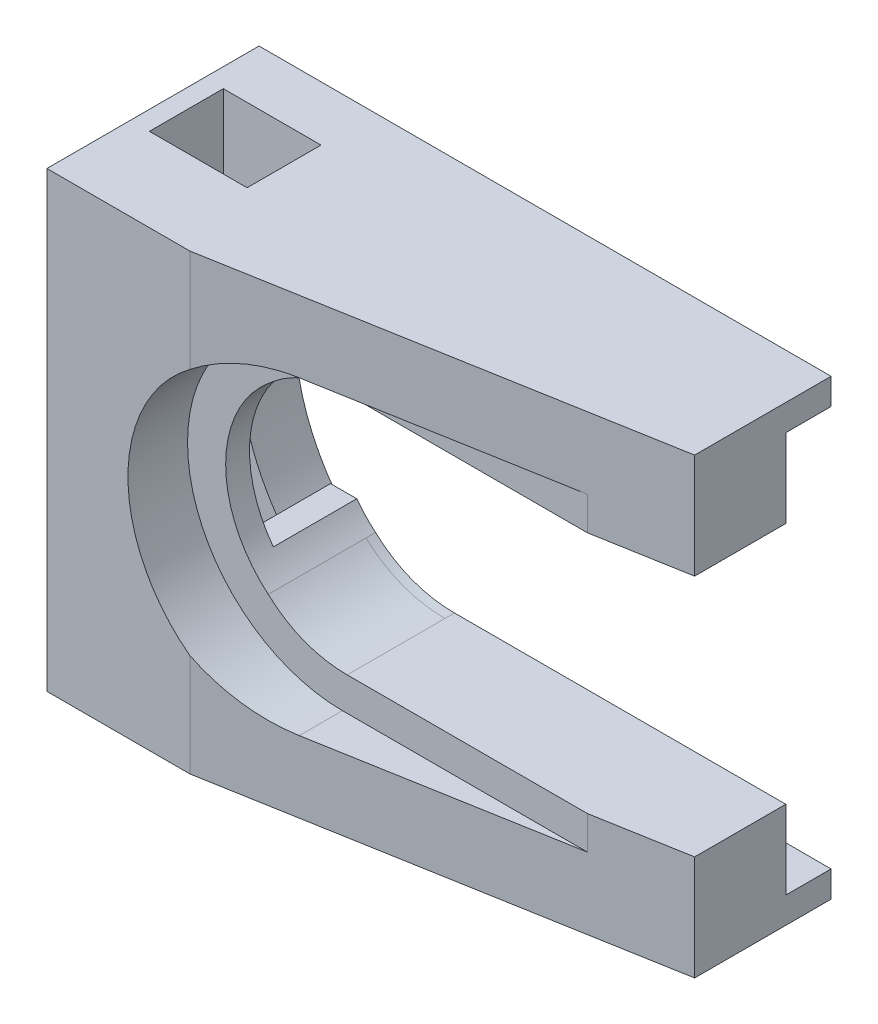
from build123d import *

# Parameters (mm, degrees)
SKETCH_1_24X19_W         = 19
SKETCH_1_24X19_H         = 24
EXTRUDE_1_33_DEPTH       = 33
CUT_EXTRUDE_2_REACH      = 38.377
CUT_EXTRUDE_4_2_DEPTH    = 1.9
CUT_EXTRUDE_6_3_REACH    = 29.71
SKETCH_7_5_W             = 24
SKETCH_7_5_H             = 19
EXTRUDE_7_DEPTH          = 5
CUT_EXTRUDE_10_4_REACH   = 41.925
SKETCH_11_W              = 8.5
SKETCH_11_H              = 3.1
CUT_EXTRUDE_11_5_DEPTH   = 4.9
SKETCH_11D1_W            = 6
SKETCH_11D1_H            = 3.1
CUT_EXTRUDE_11D1_6_DEPTH = 10
CUT_EXTRUDE_12_9_REACH   = 31.655
CUT_EXTRUDE_11_DEPTH     = 3.5
SKETCH_5903_W            = 53.98
SKETCH_5903_H            = 19
CUT_EXTRUDE_12_DEPTH     = 1
CUT_EXTRUDE_13_DEPTH     = 40.102429623
CUT_EXTRUDE_15_REACH     = 33.036
SKETCH_5021_R            = 3.5
EXTRUDE_2_DEPTH          = 0.4
SKETCH_7445_W            = 0.8
SKETCH_7445_H            = 3.1
EXTRUDE_3_DEPTH          = 19
CUT_EXTRUDE_16_DEPTH     = 32.036269144
SKETCH_14_W              = 54.018014823
SKETCH_14_H              = 29.926878018
CUT_EXTRUDE_17_DEPTH     = 28.710286942


with BuildPart() as part:
    # 1底部方形_24x19 → 1凸台-拉伸_高33 (new body)
    with BuildSketch(Plane(origin=(0, 0, 0), x_dir=(0, 1, 0), z_dir=(0, 0, 1))):
        Rectangle(SKETCH_1_24X19_W, SKETCH_1_24X19_H)
    extrude(amount=EXTRUDE_1_33_DEPTH)

    # 2吸嘴停靠渐变槽 → 2切除-拉伸 (cut, up to next)
    with BuildSketch(Plane.XY.offset(33), mode=Mode.PRIVATE) as cut_extrude_2_sk1:
        with BuildLine():
            Line((12, -5.1), (12, 5.1))
            Line((12, 5.1), (-1.9, 5.1))
            add(Edge.make_bspline(
                [(-5.213938048, 3.830222216), (-3.829124073, 5.093205317), (-1.9, 5.1)],
                knots=[0, 0, 0, 1, 1, 1], degree=2))
            ThreePointArc((-5.213938048, 3.830222216), (-7, 0), (-5.213938048, -3.830222216))
            add(Edge.make_bspline(
                [(-5.213938048, -3.830222216), (-3.829124073, -5.093205317), (-1.9, -5.1)],
                knots=[0, 0, 0, 1, 1, 1], degree=2))
            Line((-1.9, -5.1), (12, -5.1))
        make_face()
    cut_extrude_2_tool1 = extrude(cut_extrude_2_sk1.sketch, amount=-CUT_EXTRUDE_2_REACH, mode=Mode.PRIVATE) & part.part
    add(cut_extrude_2_tool1.solids().sort_by_distance((3.017719, 0, 33))[0], mode=Mode.SUBTRACT)

    # 4反光板停靠槽 → 4切除-拉伸2 (cut)
    with BuildSketch(Plane.XY.offset(25)):
        with BuildLine():
            Line((-0.7, 8.4), (12, 8.4))
            Line((12, 8.4), (12, -8.4))
            Line((12, -8.4), (-0.7, -8.4))
            ThreePointArc((-0.7, -8.4), (-10.5, 0), (-0.7, 8.4))
        make_face()
    extrude(amount=-CUT_EXTRUDE_4_2_DEPTH, mode=Mode.SUBTRACT)

    # 6反光板小圆柱 → 6切除-拉伸3 (cut, up to next)
    with BuildSketch(Plane.XY.offset(23.1), mode=Mode.PRIVATE) as cut_extrude_6_3_sk1:
        with BuildLine():
            Line((-2.1, -6.3), (12, -6.3))
            Line((12, -6.3), (12, 6.3))
            Line((12, 6.3), (-2.1, 6.3))
            ThreePointArc((-2.1, 6.3), (-8.4, 0), (-2.1, -6.3))
        make_face()
    cut_extrude_6_3_tool1 = extrude(cut_extrude_6_3_sk1.sketch, amount=-CUT_EXTRUDE_6_3_REACH, mode=Mode.PRIVATE) & part.part
    add(cut_extrude_6_3_tool1.solids().sort_by_distance((2.424095, 0, 23.1))[0], mode=Mode.SUBTRACT)

    # 7草图5 → 7凸台-拉伸_底板厚度 (add)
    with BuildSketch(Plane(origin=(0, 0, 0), x_dir=(1, 0, 0), z_dir=(0, 0, -1))):
        Rectangle(SKETCH_7_5_W, SKETCH_7_5_H)
    extrude(amount=-EXTRUDE_7_DEPTH)

    # 10切除-拉伸4: up to this face of the body (flat: up to its plane)
    cut_extrude_10_4_end = Plane(part.part.faces().sort_by_distance((0, -9.5, 16.5))[0])
    # Sketch 10 → 10切除-拉伸4 (cut, up to the picked face)
    with BuildSketch(Plane(origin=(0, 9.5, 0), x_dir=(-1, 0, 0), z_dir=(0, 1, 0)), mode=Mode.PRIVATE) as cut_extrude_10_4_sk1:
        Polygon((-12, 31.162738066), (-12, 33), (9, 33), align=None)
    cut_extrude_10_4_tool1 = split(extrude(cut_extrude_10_4_sk1.sketch, amount=-CUT_EXTRUDE_10_4_REACH, mode=Mode.PRIVATE), bisect_by=cut_extrude_10_4_end, keep=Keep.BOTH, mode=Mode.PRIVATE)
    add(cut_extrude_10_4_tool1.solids().sort_by(Axis((5, 9.5, 32.387579), (0, -1, 0)))[0], mode=Mode.SUBTRACT)

    # Sketch 11 → 11切除-拉伸5 (cut)
    with BuildSketch(Plane(origin=(-12, 0, 0), x_dir=(0, -1, 0), z_dir=(-1, 0, 0))):
        with Locations((-5.25, 26.95)):
            Rectangle(SKETCH_11_W, SKETCH_11_H)
        with Locations((5.25, 26.95)):
            Rectangle(SKETCH_11_W, SKETCH_11_H)
    extrude(amount=-CUT_EXTRUDE_11_5_DEPTH, mode=Mode.SUBTRACT)

    # 11d1_磁铁开窗 → 11d1切除-拉伸6 (cut)
    with BuildSketch(Plane(origin=(-12, 0, 0), x_dir=(0, -1, 0), z_dir=(-1, 0, 0))):
        with Locations((0, 26.95)):
            Rectangle(SKETCH_11D1_W, SKETCH_11D1_H)
    extrude(amount=-CUT_EXTRUDE_11D1_6_DEPTH, mode=Mode.SUBTRACT)

    # 12切除薄壁 → 12切除-拉伸9 (cut, up to next)
    with BuildSketch(Plane.XY.offset(25.4), mode=Mode.PRIVATE) as cut_extrude_12_9_sk1:
        with BuildLine():
            Line((-0.7, 8.4), (-0.7, -8.4))
            ThreePointArc((-0.7, -8.4), (-10.5, 0), (-0.7, 8.4))
        make_face()
    cut_extrude_12_9_tool1 = extrude(cut_extrude_12_9_sk1.sketch, amount=-CUT_EXTRUDE_12_9_REACH, mode=Mode.PRIVATE) & part.part
    add(cut_extrude_12_9_tool1.solids().sort_by_distance((-4.916056, 0, 25.4))[0], mode=Mode.SUBTRACT)

    # Sketch 5393 → 切除-拉伸11 (cut)
    with BuildSketch(Plane.XY.offset(33)):
        with BuildLine():
            Line((-2.099999748, 6.5), (12, 6.5))
            Line((12, 6.5), (12, -6.5))
            Line((12, -6.5), (-2.099999748, -6.5))
            ThreePointArc((-2.099999748, -6.5), (-8.6, 0), (-2.099999748, 6.5))
        make_face()
    extrude(amount=-CUT_EXTRUDE_11_DEPTH, mode=Mode.SUBTRACT)

    # Sketch 5903 → 切除-拉伸12 (cut)
    with BuildSketch(Plane.XY.offset(33)):
        with Locations((14.99, 0)):
            Rectangle(SKETCH_5903_W, SKETCH_5903_H)
    extrude(amount=-CUT_EXTRUDE_12_DEPTH, mode=Mode.SUBTRACT)

    # Sketch 6208 → 切除-拉伸13 (cut, through all)
    with BuildSketch(Plane.XZ.offset(9.5)):
        Polygon((2.430052303, 32), (12, 31.162738066), (12, 28.826114347), (-6, 32), align=None)
    extrude(amount=-CUT_EXTRUDE_13_DEPTH, mode=Mode.SUBTRACT)

    # Sketch 5021 → 切除-拉伸15 (cut, up to next)
    with BuildSketch(Plane.XY.offset(5), mode=Mode.PRIVATE) as cut_extrude_15_sk1:
        with Locations((2, 0)):
            Circle(SKETCH_5021_R)
    cut_extrude_15_tool1 = extrude(cut_extrude_15_sk1.sketch, amount=-CUT_EXTRUDE_15_REACH, mode=Mode.PRIVATE) & part.part
    add(cut_extrude_15_tool1.solids().sort_by_distance((2, 0, 5))[0], mode=Mode.SUBTRACT)

    # Sketch 6983 → 凸台-拉伸2 (add)
    with BuildSketch(Plane(origin=(0, 0, 25.4), x_dir=(1, 0, 0), z_dir=(0, 0, -1))):
        with BuildLine():
            Line((-7.1, -3), (-7.1, -6.8))
            ThreePointArc((-7.1, -6.8), (-4.061552813, -8.246211251), (-0.7, -8.4))
            Line((-0.7, -8.4), (-0.7, -5.1))
            Line((-0.7, -5.1), (-1.9, -5.1))
            add(Edge.make_bspline(
                [(-1.9, -5.1), (-3.829124073, -5.093205317), (-5.213938048, -3.830222216)],
                knots=[0, 0, 0, 1, 1, 1], degree=2))
            ThreePointArc((-5.213938048, -3.830222216), (-5.630777158, -3.437652866), (-6, -3))
            Line((-6, -3), (-7.1, -3))
        make_face()
        with BuildLine():
            Line((-7.1, 3), (-6, 3))
            ThreePointArc((-6, 3), (-5.630777158, 3.437652866), (-5.213938048, 3.830222216))
            add(Edge.make_bspline(
                [(-5.213938048, 3.830222216), (-3.829124073, 5.093205317), (-1.9, 5.1)],
                knots=[0, 0, 0, 1, 1, 1], degree=2))
            Line((-1.9, 5.1), (-0.7, 5.1))
            Line((-0.7, 5.1), (-0.7, 8.4))
            ThreePointArc((-0.7, 8.4), (-4.061552813, 8.246211251), (-7.1, 6.8))
            Line((-7.1, 6.8), (-7.1, 3))
        make_face()
    extrude(amount=EXTRUDE_2_DEPTH)

    # Sketch 7445 → 凸台-拉伸3 (add)
    with BuildSketch(Plane.XZ.offset(9.5)):
        with Locations((-11.6, 26.95)):
            Rectangle(SKETCH_7445_W, SKETCH_7445_H)
    extrude(amount=-EXTRUDE_3_DEPTH)

    # 草图13 → 切除-拉伸16 (cut, through all)
    with BuildSketch(Plane.XY.offset(5)):
        with BuildLine():
            Line((-2.1, -6.3), (12, -6.3))
            Line((12, -6.3), (12, 6.3))
            Line((12, 6.3), (-2.1, 6.3))
            ThreePointArc((-2.1, 6.3), (-8.4, 0), (-2.1, -6.3))
        make_face()
    extrude(amount=-CUT_EXTRUDE_16_DEPTH, mode=Mode.SUBTRACT)

    # 草图14 → 切除-拉伸17 (cut, through all)
    with BuildSketch(Plane.XY.offset(23.1)):
        with Locations((6.444750957, 0.291135192)):
            Rectangle(SKETCH_14_W, SKETCH_14_H)
    extrude(amount=-CUT_EXTRUDE_17_DEPTH, mode=Mode.SUBTRACT)


solid = part.part
